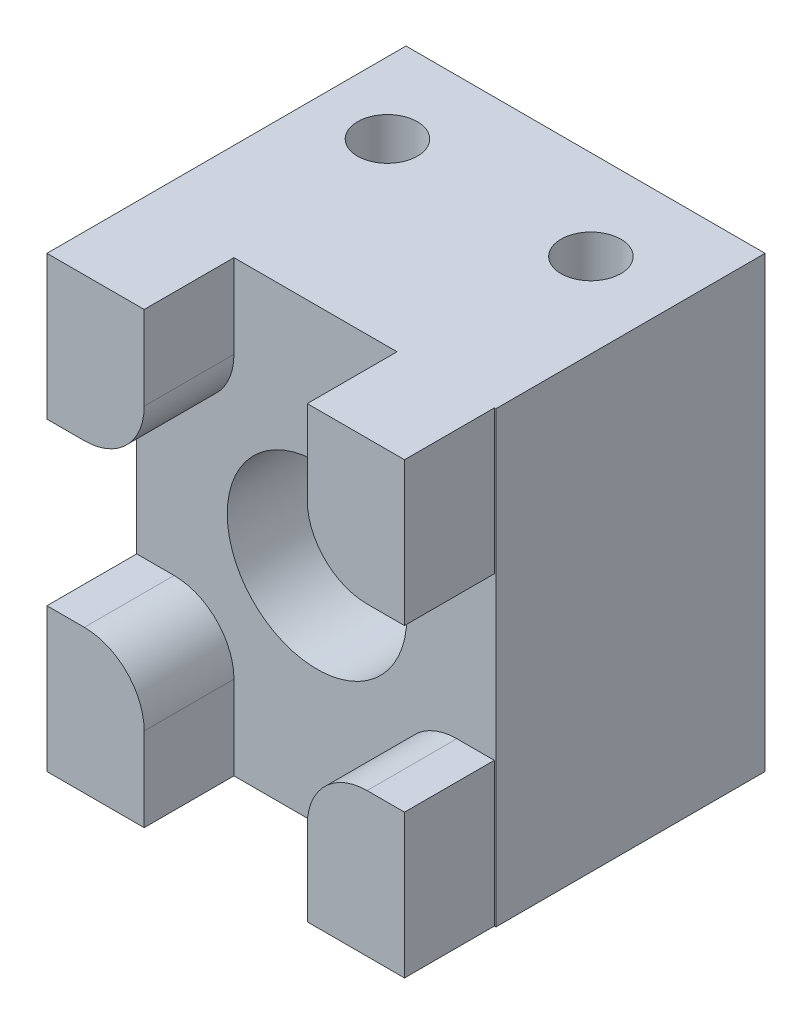
from build123d import *

# Parameters (mm, degrees)
SKETCH1_W           = 12
SKETCH1_H           = 15
BOSS_EXTRUDE1_DEPTH = 9
SKETCH2_W           = 3.25
SKETCH2_H           = 4.8
BOSS_EXTRUDE2_DEPTH = 3
SKETCH3_R           = 3
CUT_EXTRUDE1_DEPTH  = 501.290165804
FILLET1_R           = 2
SKETCH4_R           = 1
CUT_EXTRUDE2_DEPTH  = 15


with BuildPart() as part:
    # Sketch1 → Boss-Extrude1 (new body)
    with BuildSketch(Plane.XY.offset(20)):
        with Locations((231, 433)):
            Rectangle(SKETCH1_W, SKETCH1_H)
    extrude(amount=BOSS_EXTRUDE1_DEPTH)

    # Sketch2 → Boss-Extrude2 (add)
    with BuildSketch(Plane.XY.offset(29)):
        with Locations((235.325, 438.1)):
            Rectangle(SKETCH2_W, SKETCH2_H)
        with Locations((226.625, 438.1)):
            Rectangle(SKETCH2_W, SKETCH2_H)
        with Locations((235.325, 427.9)):
            Rectangle(SKETCH2_W, SKETCH2_H)
        with Locations((226.625, 427.9)):
            Rectangle(SKETCH2_W, SKETCH2_H)
    extrude(amount=BOSS_EXTRUDE2_DEPTH)

    # Sketch3 → Cut-Extrude1 (cut, through all)
    with BuildSketch(Plane.XY.offset(29)):
        with Locations((231.026544884, 432.975080758)):
            Circle(SKETCH3_R)
    extrude(amount=-CUT_EXTRUDE1_DEPTH, mode=Mode.SUBTRACT)

    # Fillet1
    fillet1_edges = [part.edges().sort_by_distance(p)[0] for p in [
        (228.25, 435.7, 30.5),
        (233.7, 435.7, 30.5),
        (233.7, 430.3, 30.5),
        (228.25, 430.3, 30.5),
    ]]
    fillet(fillet1_edges, radius=FILLET1_R)

    # Sketch4 → Cut-Extrude2 (cut)
    with BuildSketch(Plane(origin=(0, 425.5, 0), x_dir=(-1, 0, 0), z_dir=(0, -1, 0))):
        with Locations(Location((-227.379453892, -23, 0), (0, 0, 90))):
            Circle(SKETCH4_R)
        with Locations(Location((-234.179453892, -23, 0), (0, 0, 90))):
            Circle(SKETCH4_R)
    extrude(amount=-CUT_EXTRUDE2_DEPTH, mode=Mode.SUBTRACT)


solid = part.part
